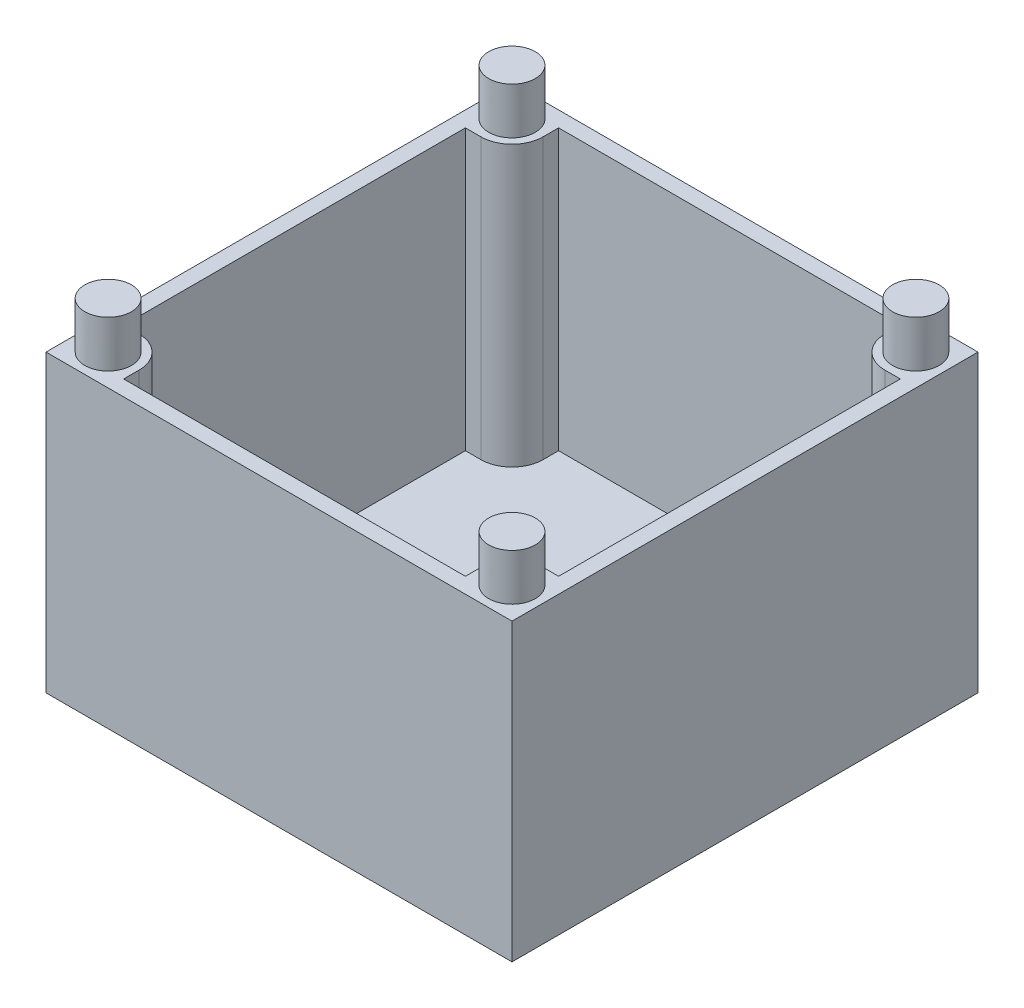
from build123d import *

# Parameters (mm, degrees)
SKETCH_1_W          = 15
SKETCH_1_H          = 15
EXTRUDE_1_DEPTH     = 9.5
CUT_EXTRUDE_1_DEPTH = 9
SKETCH_5_R          = 0.75
EXTRUDE_2_DEPTH     = 1.5


with BuildPart() as part:
    # 草图1 → 凸台-拉伸1 (new body)
    with BuildSketch(Plane(origin=(0, 0, 0), x_dir=(1, 0, 0), z_dir=(0, 1, 0))):
        Rectangle(SKETCH_1_W, SKETCH_1_H)
    extrude(amount=EXTRUDE_1_DEPTH)

    # 草图2 → 切除-拉伸1 (cut)
    with BuildSketch(Plane(origin=(0, 9.5, 0), x_dir=(-1, 0, 0), z_dir=(0, 1, 0))):
        with BuildLine():
            Line((6.5, -5.5), (7, -5.5))
            Line((7, -5.5), (7, 5.5))
            Line((7, 5.5), (6.5, 5.5))
            ThreePointArc((6.5, 5.5), (5.792893219, 5.792893219), (5.5, 6.5))
            Line((5.5, 6.5), (5.5, 7))
            Line((5.5, 7), (-5.5, 7))
            Line((-5.5, 7), (-5.5, 6.5))
            ThreePointArc((-5.5, 6.5), (-5.792893219, 5.792893219), (-6.5, 5.5))
            Line((-6.5, 5.5), (-7, 5.5))
            Line((-7, 5.5), (-7, -5.5))
            Line((-7, -5.5), (-6.5, -5.5))
            ThreePointArc((-6.5, -5.5), (-5.792893219, -5.792893219), (-5.5, -6.5))
            Line((-5.5, -6.5), (-5.5, -7))
            Line((-5.5, -7), (5.5, -7))
            Line((5.5, -7), (5.5, -6.5))
            ThreePointArc((5.5, -6.5), (5.792893219, -5.792893219), (6.5, -5.5))
        make_face()
    extrude(amount=-CUT_EXTRUDE_1_DEPTH, mode=Mode.SUBTRACT)

    # 草图5 → 凸台-拉伸2 (add)
    with BuildSketch(Plane(origin=(0, 9.5, 0), x_dir=(-1, 0, 0), z_dir=(0, 1, 0))):
        with Locations(Location((6.5, -6.5, 0), (0, 0, 270))):
            Circle(SKETCH_5_R)
        with Locations(Location((6.5, 6.5, 0), (0, 0, 270))):
            Circle(SKETCH_5_R)
        with Locations(Location((-6.5, 6.5, 0), (0, 0, 270))):
            Circle(SKETCH_5_R)
        with Locations(Location((-6.5, -6.5, 0), (0, 0, 270))):
            Circle(SKETCH_5_R)
    extrude(amount=EXTRUDE_2_DEPTH)


solid = part.part
